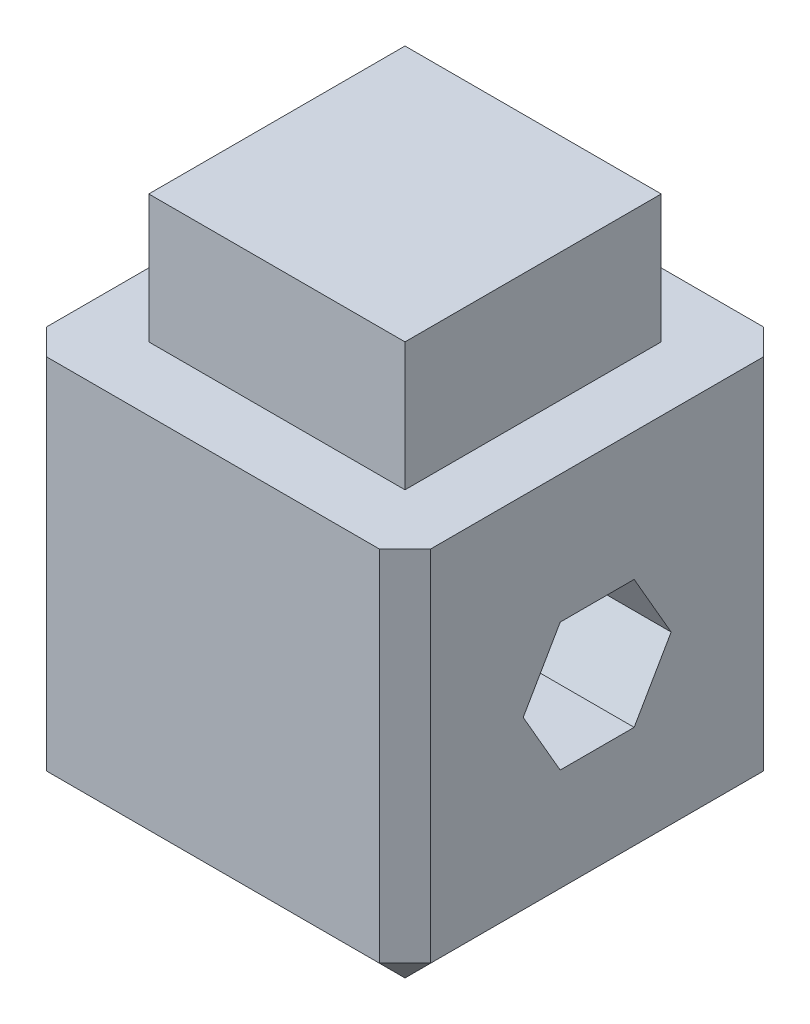
from build123d import *

# Parameters (mm, degrees)
SKETCH1_W           = 38.1
SKETCH1_H           = 38.1
BOSS_EXTRUDE1_DEPTH = 50.8
SKETCH2_W           = 38.1
SKETCH2_H           = 38.1
SKETCH2_W_2         = 25.4
SKETCH2_H_2         = 25.4
CUT_EXTRUDE1_DEPTH  = 12.7
CUT_EXTRUDE2_DEPTH  = 67.295946332
CHAMFER1_SIZE       = 2.54


with BuildPart() as part:
    # Sketch1 → Boss-Extrude1 (new body)
    with BuildSketch(Plane(origin=(0, 0, 0), x_dir=(1, 0, 0), z_dir=(0, 1, 0))):
        Rectangle(SKETCH1_W, SKETCH1_H)
    extrude(amount=BOSS_EXTRUDE1_DEPTH)

    # Sketch2 → Cut-Extrude1 (cut)
    with BuildSketch(Plane(origin=(0, 50.8, 0), x_dir=(1, 0, 0), z_dir=(0, 1, 0))):
        Rectangle(SKETCH2_W, SKETCH2_H)
        Rectangle(SKETCH2_W_2, SKETCH2_H_2, mode=Mode.SUBTRACT)
    extrude(amount=-CUT_EXTRUDE1_DEPTH, mode=Mode.SUBTRACT)

    # Sketch3 → Cut-Extrude2 (cut, through all)
    with BuildSketch(Plane(origin=(19.05, 0, 0), x_dir=(0, 0, -1), z_dir=(1, 0, 0))):
        Polygon((-7.332348419, 19.05), (-3.666174209, 12.7), (3.666174209, 12.7), (7.332348419, 19.05), (3.666174209, 25.4), (-3.666174209, 25.4), align=None)
    extrude(amount=-CUT_EXTRUDE2_DEPTH, mode=Mode.SUBTRACT)

    # Chamfer1
    chamfer1_edges = [part.edges().sort_by_distance(p)[0] for p in [
        (19.05, 19.05, 19.05),
        (-19.05, 19.05, 19.05),
        (-19.05, 19.05, -19.05),
        (19.05, 19.05, -19.05),
        (0, 0, 19.05),
        (-19.05, 0, 0),
        (0, 0, -19.05),
        (19.05, 0, 0),
    ]]
    chamfer(chamfer1_edges, length=CHAMFER1_SIZE)


solid = part.part
